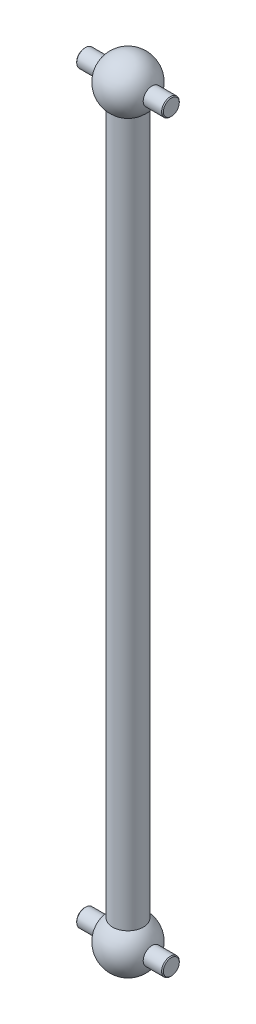
from build123d import *

# Parameters (mm, degrees)
ESQUISSE2_R        = 1
BOSS_EXTRU_1_DEPTH = 4.9
CHANFREIN1_SIZE    = 0.1


with BuildPart() as part:
    # Esquisse1 → Révolution1 (revolve)
    with BuildSketch(Plane.XY):
        with BuildLine():
            Line((-1.75, -39.787533784), (-1.75, 39.787533784))
            ThreePointArc((-1.75, 39.787533784), (-2.749195521, 43.022997284), (0, 45))
            Line((0, 45), (0, -45))
            ThreePointArc((0, -45), (-2.749195521, -43.022997284), (-1.75, -39.787533784))
        make_face()
    revolve(axis=Axis((0, 45, 0), (0, -1, 0)))

    # Esquisse2 → Boss.-Extru.1 (add, symmetric)
    with BuildSketch(Plane(origin=(0, 0, 0), x_dir=(0, 0, -1), z_dir=(1, 0, 0))):
        with Locations((0, 42.1)):
            Circle(ESQUISSE2_R)
    boss_extru_1 = extrude(amount=BOSS_EXTRU_1_DEPTH, both=True)

    # Symétrie3: Boss.-Extru.1 across plane
    add(boss_extru_1.mirror(Plane.ZX))

    # Chanfrein1
    chanfrein1_edges = [part.edges().sort_by_distance(p)[0] for p in [
        (4.9, 42.1, 1),
        (-4.9, 42.1, 1),
        (4.9, -42.1, 1),
        (-4.9, -42.1, 1),
    ]]
    chamfer(chanfrein1_edges, length=CHANFREIN1_SIZE)


solid = part.part
